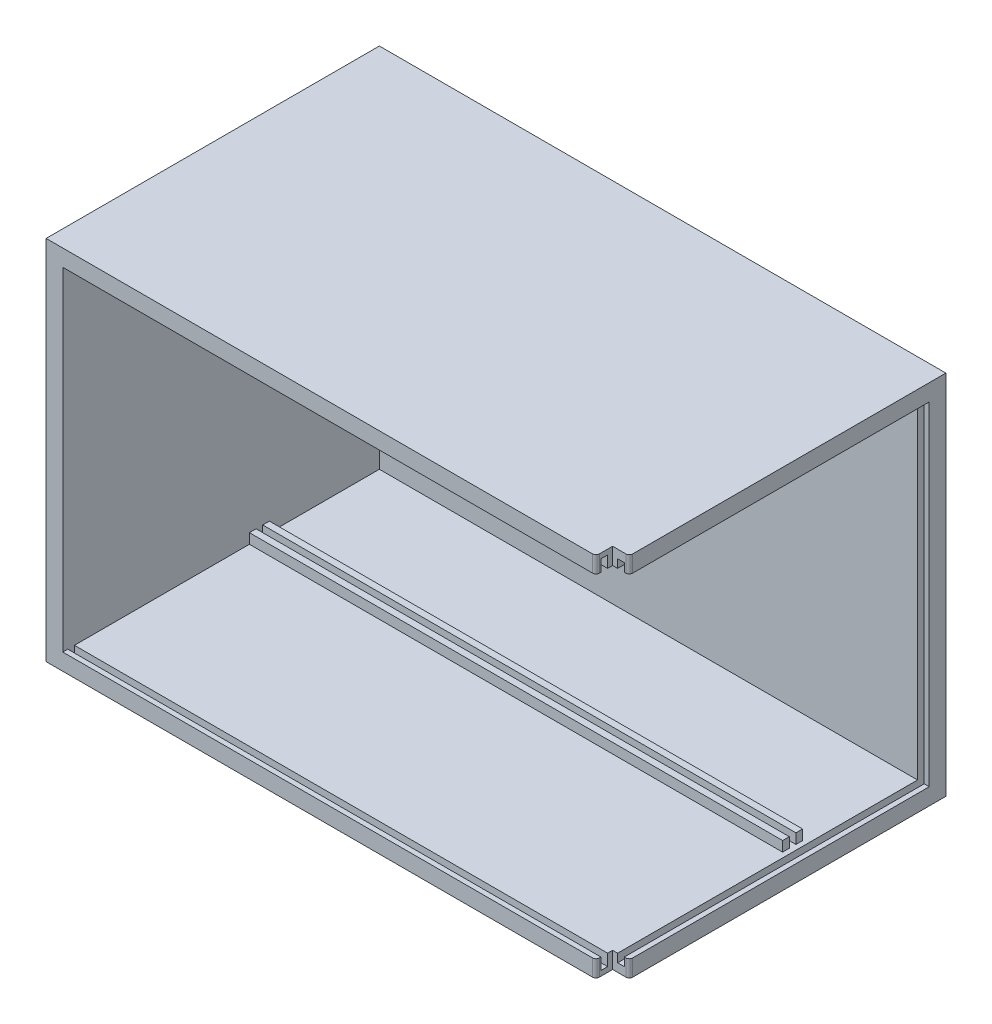
from build123d import *

# Parameters (mm, degrees)
BOSS_EXTRUDE1_DEPTH   = 90
BOSS_EXTRUDE1_2_DEPTH = 90
SKETCH3_W             = 2
SKETCH3_H             = 3.026273801
EXTRUDE_THIN1_DEPTH   = 160
SKETCH5_W             = 160
SKETCH5_H             = 110
BOSS_EXTRUDE2_DEPTH   = 5
BOSS_EXTRUDE3_DEPTH   = 5
SKETCH7_W             = 2
SKETCH7_H             = 100
CUT_EXTRUDE1_DEPTH    = 2.5
SKETCH8_W             = 2
SKETCH8_H             = 90
CUT_EXTRUDE2_DEPTH    = 2.5
SKETCH9_W             = 2
SKETCH9_H             = 90
CUT_EXTRUDE3_DEPTH    = 2.5
SKETCH10_W            = 2
SKETCH10_H            = 2.5
CUT_EXTRUDE4_DEPTH    = 2.5
BOSS_EXTRUDE4_DEPTH   = 160
SKETCH12_W            = 100
SKETCH12_H            = 110
BOSS_EXTRUDE5_DEPTH   = 5
FILLET1_R             = 1


with BuildPart() as part:
    # Sketch2 → Boss-Extrude1 (new body)
    with BuildSketch(Plane.XY):
        Polygon((80, 55), (-80, 55), (-80, 50), (-75, 50), (75, 50), (80, 50), align=None)
    extrude(amount=BOSS_EXTRUDE1_DEPTH)



with BuildPart() as body_2:
    # Sketch2 → Boss-Extrude1 2 (new body)
    with BuildSketch(Plane.XY):
        Polygon((-75, -50), (-80, -50), (-80, -55), (80, -55), (80, -50), (75, -50), align=None)
    extrude(amount=BOSS_EXTRUDE1_2_DEPTH)


with BuildPart() as part_1:
    add(part.part)

    add(body_2.part)  # Extrude-Thin1 merges body 2
    # Sketch3 → Extrude-Thin1 (add)
    with BuildSketch(Plane(origin=(80, 0, 0), x_dir=(0, 0, -1), z_dir=(1, 0, 0))):
        with Locations((-36, 48.486863099)):
            Rectangle(SKETCH3_W, SKETCH3_H)
        with Locations((-34, -48.486863099)):
            Rectangle(SKETCH3_W, SKETCH3_H)
        with Locations((-40, 48.486863099)):
            Rectangle(SKETCH3_W, SKETCH3_H)
        with Locations((-38, -48.486863099)):
            Rectangle(SKETCH3_W, SKETCH3_H)
    extrude(amount=-EXTRUDE_THIN1_DEPTH)

    # Sketch5 → Boss-Extrude2 (add)
    with BuildSketch(Plane(origin=(0, 0, 0), x_dir=(-1, 0, 0), z_dir=(0, 0, -1))):
        Rectangle(SKETCH5_W, SKETCH5_H)
    extrude(amount=BOSS_EXTRUDE2_DEPTH)

    # Sketch6 → Boss-Extrude3 (add)
    with BuildSketch(Plane(origin=(80, 0, 0), x_dir=(0, 0, -1), z_dir=(1, 0, 0))):
        Polygon((-90, 55), (-90, 50), (0, 50), (0, -50), (-90, -50), (-90, -55), (5, -55), (5, 55), align=None)
    extrude(amount=BOSS_EXTRUDE3_DEPTH)

    # Sketch7 → Cut-Extrude1 (cut)
    with BuildSketch(Plane.XY):
        with Locations((82.5, 0)):
            Rectangle(SKETCH7_W, SKETCH7_H)
    extrude(amount=-CUT_EXTRUDE1_DEPTH, mode=Mode.SUBTRACT)

    # Sketch8 → Cut-Extrude2 (cut)
    with BuildSketch(Plane.XZ.offset(-50)):
        with Locations((82.5, 45)):
            Rectangle(SKETCH8_W, SKETCH8_H)
    extrude(amount=-CUT_EXTRUDE2_DEPTH, mode=Mode.SUBTRACT)

    # Sketch9 → Cut-Extrude3 (cut)
    with BuildSketch(Plane(origin=(0, -50, 0), x_dir=(1, 0, 0), z_dir=(0, 1, 0))):
        with Locations((82.5, -45)):
            Rectangle(SKETCH9_W, SKETCH9_H)
    extrude(amount=-CUT_EXTRUDE3_DEPTH, mode=Mode.SUBTRACT)

    # Sketch10 → Cut-Extrude4 (cut)
    with BuildSketch(Plane.XY):
        with Locations((82.5, 51.25)):
            Rectangle(SKETCH10_W, SKETCH10_H)
        with Locations((82.5, -51.25)):
            Rectangle(SKETCH10_W, SKETCH10_H)
    extrude(amount=-CUT_EXTRUDE4_DEPTH, mode=Mode.SUBTRACT)

    # Sketch11 → Boss-Extrude4 (add)
    with BuildSketch(Plane.ZY.offset(80)):
        Polygon((90, 50), (90, 55), (95, 55), (95, 50), (93.5, 50), (93.5, 53.5), (91.5, 53.5), (91.5, 50), align=None)
        Polygon((91.5, -53.5), (93.5, -53.5), (93.5, -50), (95, -50), (95, -55), (90, -55), (90, -50), (91.5, -50), align=None)
    extrude(amount=-BOSS_EXTRUDE4_DEPTH)

    # Sketch12 → Boss-Extrude5 (add)
    with BuildSketch(Plane.ZY.offset(80)):
        with Locations((45, 0)):
            Rectangle(SKETCH12_W, SKETCH12_H)
    extrude(amount=BOSS_EXTRUDE5_DEPTH)

    # Fillet1
    fillet1_edges = [part_1.edges().sort_by_distance(p)[0] for p in [
        (80, 52.5, 95),
        (80, -52.5, 95),
        (85, 52.5, 90),
        (85, -52.5, 90),
    ]]
    fillet(fillet1_edges, radius=FILLET1_R)


solid = part_1.part
